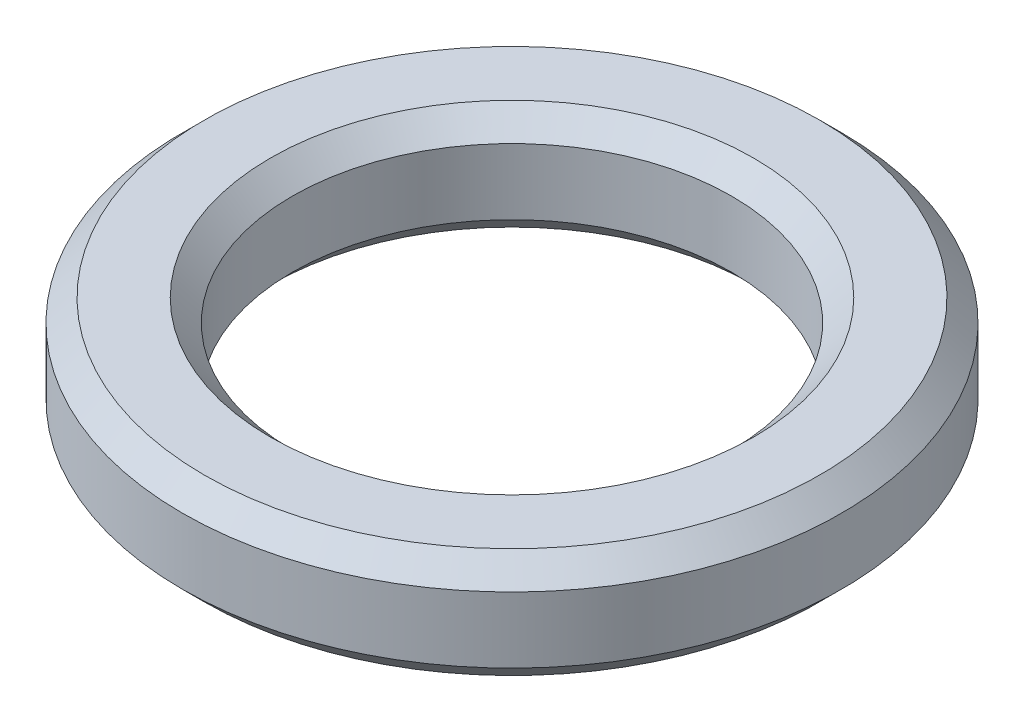
from build123d import *

# Parameters (mm, degrees)
SKETCH1_R           = 15
SKETCH1_R_2         = 10
EXTRUDE_THIN1_DEPTH = 5
CHAMFER1_SIZE       = 1


with BuildPart() as part:
    # Sketch1 → Extrude-Thin1 (new body)
    with BuildSketch(Plane(origin=(0, 0, 0), x_dir=(1, 0, 0), z_dir=(0, 1, 0))):
        Circle(SKETCH1_R)
        Circle(SKETCH1_R_2, mode=Mode.SUBTRACT)
    extrude(amount=EXTRUDE_THIN1_DEPTH)

    # Chamfer1
    chamfer1_edges = [part.edges().sort_by_distance(p)[0] for p in [
        (-15, 0, 0),
        (-15, 5, 0),
        (-10, 0, 0),
        (-10, 5, 0),
    ]]
    chamfer(chamfer1_edges, length=CHAMFER1_SIZE)


solid = part.part
